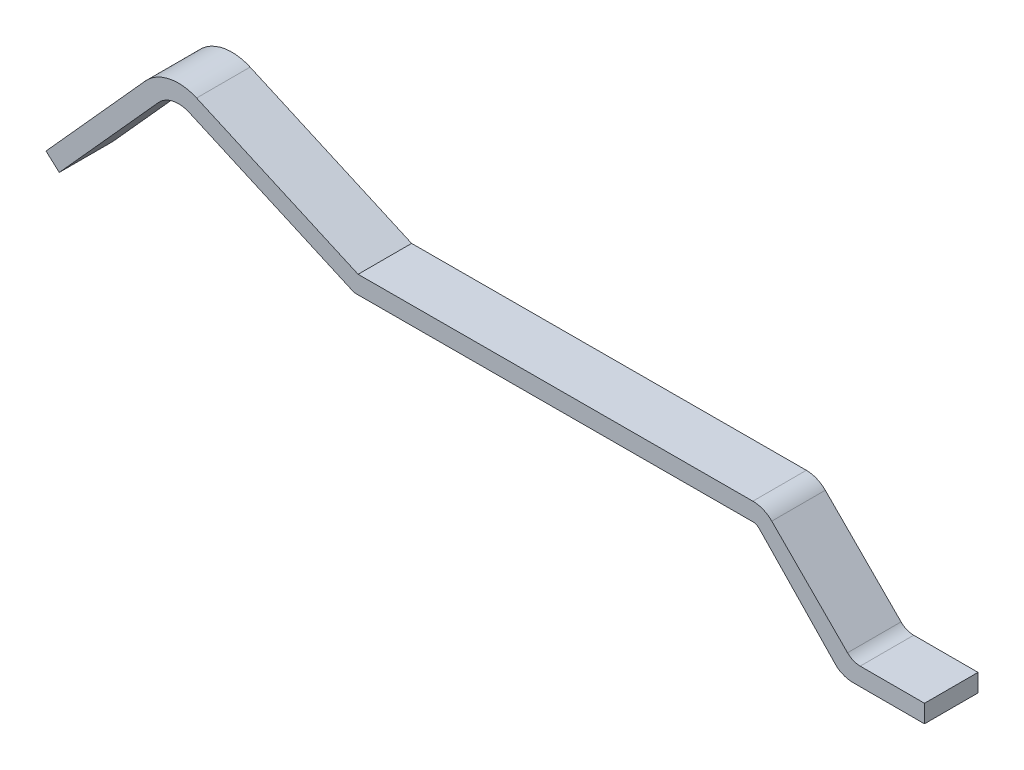
from build123d import *

# Parameters (mm, degrees)
RESSALTO_EXTRUS_O1_DEPTH = 0.3


with BuildPart() as part:
    # Esboço1 → Ressalto-extrusão1 (new, symmetric)
    with BuildSketch(Plane.XY):
        with BuildLine():
            Line((18.8, 0.2), (18.8, 0))
            Line((18.8, 0), (18, 0))
            ThreePointArc((18, 0), (17.90513167, 0.015395011), (17.82, 0.06))
            Line((17.82, 0.06), (16.946446609, 0.970710678))
            ThreePointArc((16.946446609, 0.970710678), (16.914021314, 0.992429091), (16.875735931, 1))
            Line((16.875735931, 1), (12.407488688, 0.99))
            Line((12.407488688, 0.99), (10.557971552, 1.813458083))
            ThreePointArc((10.557971552, 1.813458083), (10.373577052, 1.832838725), (10.213007112, 1.740133627))
            Line((10.213007112, 1.740133627), (9.099531826, 0.503494039))
            Line((9.099531826, 0.503494039), (8.95090286, 0.637320161))
            Line((8.95090286, 0.637320161), (10.064378147, 1.873959748))
            ThreePointArc((10.064378147, 1.873959748), (10.331994714, 2.028468246), (10.639318881, 1.996167174))
            Line((10.639318881, 1.996167174), (12.45, 1.19))
            Line((12.45, 1.19), (16.875735931, 1.2))
            ThreePointArc((16.875735931, 1.2), (16.990592571, 1.177288457), (17.087867966, 1.112132034))
            Line((17.087867966, 1.112132034), (17.937254364, 0.258898547))
            ThreePointArc((17.937254364, 0.258898547), (18.002249513, 0.215310679), (18.078994902, 0.2))
            Line((18.078994902, 0.2), (18.8, 0.2))
        make_face()
    extrude(amount=RESSALTO_EXTRUS_O1_DEPTH, both=True)


solid = part.part
